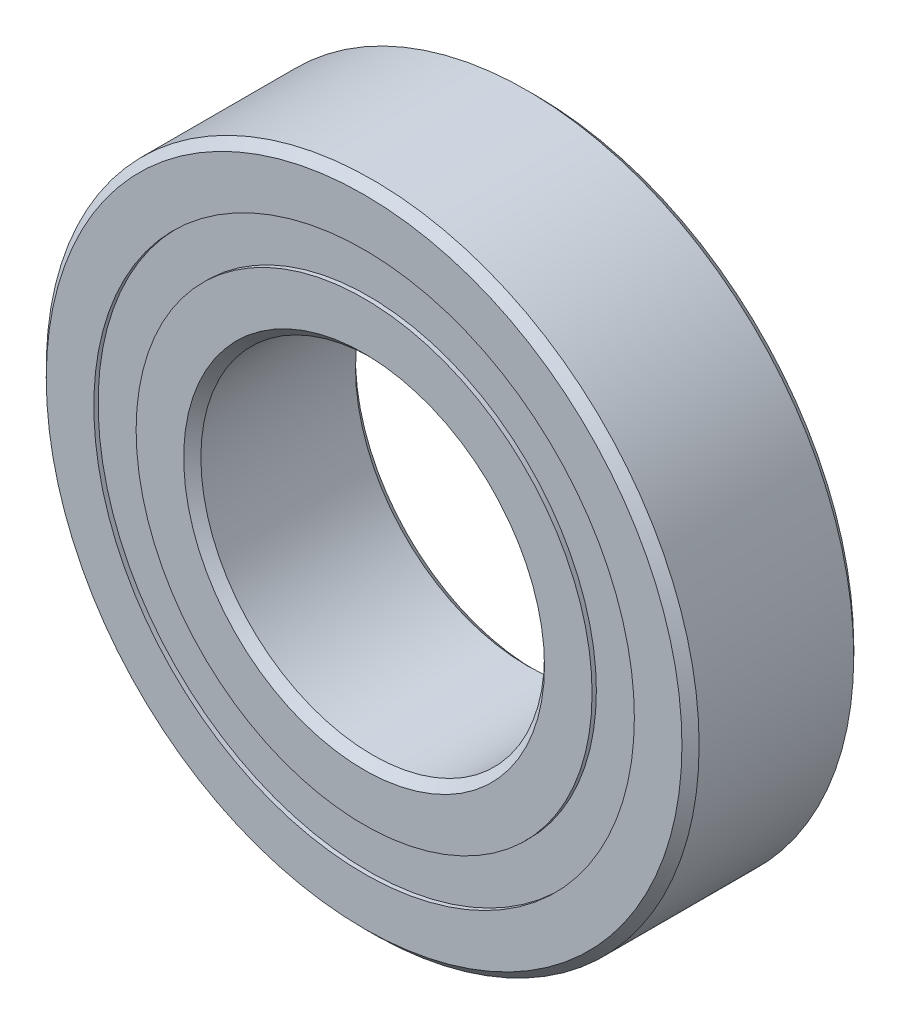
from build123d import *

# Parameters (mm, degrees)
CIRPATTERN1_COUNT = 12
SKETCH5_W         = 1.104855864
SKETCH5_H         = 1.23076923


with BuildPart() as part:
    # Sketch1 → Revolve1 (revolve)
    with BuildSketch(Plane(origin=(0, 0, 0), x_dir=(0, 0, -1), z_dir=(1, 0, 0))):
        with BuildLine():
            Line((2.25, 9.5), (-2.25, 9.5))
            Line((-2.25, 9.5), (-2.5, 9.25))
            Line((-2.5, 9.25), (-2.5, 7.865384615))
            Line((-2.5, 7.865384615), (-1.111111111, 7.865384615))
            ThreePointArc((-1.111111111, 7.865384615), (0, 8.520144136), (1.111111111, 7.865384615))
            Line((1.111111111, 7.865384615), (2.5, 7.865384615))
            Line((2.5, 7.865384615), (2.5, 9.25))
            Line((2.5, 9.25), (2.25, 9.5))
        make_face()
    revolve(axis=Axis((0, 0, 2.5), (0, 0, -1)))


with BuildPart() as body_2:
    # Sketch3 → Revolve3 (revolve)
    with BuildSketch(Plane(origin=(0, 0, 0), x_dir=(0, 0, -1), z_dir=(1, 0, 0))):
        with BuildLine():
            Line((-2.5, 6.634615385), (-1.111111111, 6.634615385))
            ThreePointArc((-1.111111111, 6.634615385), (0, 5.979855864), (1.111111111, 6.634615385))
            Line((1.111111111, 6.634615385), (2.5, 6.634615385))
            Line((2.5, 6.634615385), (2.5, 5.25))
            Line((2.5, 5.25), (2.25, 5))
            Line((2.25, 5), (-2.25, 5))
            Line((-2.25, 5), (-2.5, 5.25))
            Line((-2.5, 5.25), (-2.5, 6.634615385))
        make_face()
    revolve(axis=Axis((0, 0, 2.5), (0, 0, -1)))


with BuildPart() as body_3:
    # Sketch4 → Revolve4 (revolve)
    with BuildSketch(Plane(origin=(0, 0, 0), x_dir=(0, 0, -1), z_dir=(1, 0, 0))):
        with BuildLine():
            Line((-1.270144136, 7.25), (1.270144136, 7.25))
            ThreePointArc((1.270144136, 7.25), (0, 8.520144136), (-1.270144136, 7.25))
        make_face()
    revolve(axis=Axis((0, 7.25, 1.270144136), (0, 0, -1)))


with BuildPart() as cirpattern1_1:
    # CirPattern1: pattern copy
    add(body_3.part.rotate(Axis((0, 0, -2.5), (0, 0, 1)), 1 * 360 / CIRPATTERN1_COUNT))


with BuildPart() as cirpattern1_2:
    # CirPattern1: pattern copy
    add(body_3.part.rotate(Axis((0, 0, -2.5), (0, 0, 1)), 2 * 360 / CIRPATTERN1_COUNT))


with BuildPart() as cirpattern1_3:
    # CirPattern1: pattern copy
    add(body_3.part.rotate(Axis((0, 0, -2.5), (0, 0, 1)), 3 * 360 / CIRPATTERN1_COUNT))


with BuildPart() as cirpattern1_4:
    # CirPattern1: pattern copy
    add(body_3.part.rotate(Axis((0, 0, -2.5), (0, 0, 1)), 4 * 360 / CIRPATTERN1_COUNT))


with BuildPart() as cirpattern1_5:
    # CirPattern1: pattern copy
    add(body_3.part.rotate(Axis((0, 0, -2.5), (0, 0, 1)), 5 * 360 / CIRPATTERN1_COUNT))


with BuildPart() as cirpattern1_6:
    # CirPattern1: pattern copy
    add(body_3.part.rotate(Axis((0, 0, -2.5), (0, 0, 1)), 6 * 360 / CIRPATTERN1_COUNT))


with BuildPart() as cirpattern1_7:
    # CirPattern1: pattern copy
    add(body_3.part.rotate(Axis((0, 0, -2.5), (0, 0, 1)), 7 * 360 / CIRPATTERN1_COUNT))


with BuildPart() as cirpattern1_8:
    # CirPattern1: pattern copy
    add(body_3.part.rotate(Axis((0, 0, -2.5), (0, 0, 1)), 8 * 360 / CIRPATTERN1_COUNT))


with BuildPart() as cirpattern1_9:
    # CirPattern1: pattern copy
    add(body_3.part.rotate(Axis((0, 0, -2.5), (0, 0, 1)), 9 * 360 / CIRPATTERN1_COUNT))


with BuildPart() as cirpattern1_10:
    # CirPattern1: pattern copy
    add(body_3.part.rotate(Axis((0, 0, -2.5), (0, 0, 1)), 10 * 360 / CIRPATTERN1_COUNT))


with BuildPart() as cirpattern1_11:
    # CirPattern1: pattern copy
    add(body_3.part.rotate(Axis((0, 0, -2.5), (0, 0, 1)), 11 * 360 / CIRPATTERN1_COUNT))


with BuildPart() as body_15:
    # Sketch5 → Revolve5 (revolve)
    with BuildSketch(Plane(origin=(0, 0, 0), x_dir=(0, 0, -1), z_dir=(1, 0, 0))):
        with Locations((-1.822572068, 7.25)):
            Rectangle(SKETCH5_W, SKETCH5_H)
        with Locations((1.822572068, 7.25)):
            Rectangle(SKETCH5_W, SKETCH5_H)
    revolve(axis=Axis((0, 0, 2.5), (0, 0, -1)))


solid = Compound([part.part, body_2.part, body_3.part, cirpattern1_1.part, cirpattern1_2.part, cirpattern1_3.part, cirpattern1_4.part, cirpattern1_5.part, cirpattern1_6.part, cirpattern1_7.part, cirpattern1_8.part, cirpattern1_9.part, cirpattern1_10.part, cirpattern1_11.part, body_15.part])
